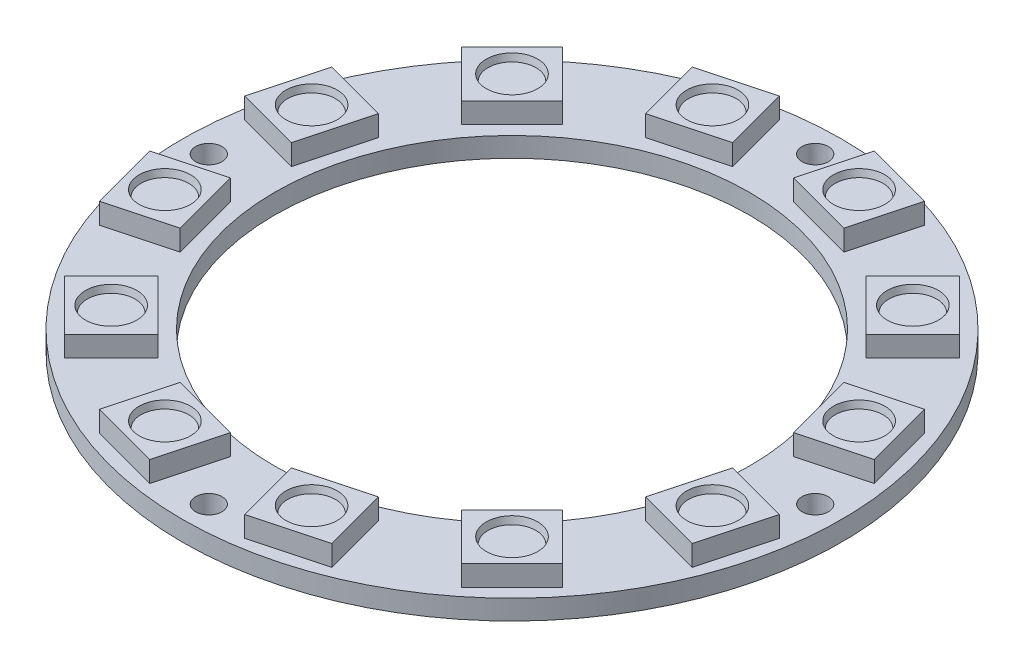
from build123d import *

# Parameters (mm, degrees)
CONTOUR_W                                   = 7
CONTOUR_H                                   = 1.5
BOSS_EXTRU_2_RGB_DEL_DEPTH                  = 1.57
R_P_TITION_CIRCULAIRE1_RGB_DEL_COUNT        = 12
BEIGNETS_SOUDURES_R                         = 0.875
BOSS_EXTRU_3_BEIGNETS_SOUDURES_DEPTH        = 0.0348
LENTILLE_R                                  = 1.95
ENL_V_MAT_EXTRU_1_LENTILLE_DEPTH            = 0.5
ENL_V_MAT_EXTRU_1_LENTILLE_DRAFT            = -15
R_P_TITION_CIRCULAIRE1_COPY_1_SKETCH_R      = 1.95
R_P_TITION_CIRCULAIRE1_COPY_1_DEPTH         = 0.5
R_P_TITION_CIRCULAIRE1_COPY_1_DRAFT         = -15
R_P_TITION_CIRCULAIRE1_COPY_2_SKETCH_R      = 1.95
R_P_TITION_CIRCULAIRE1_COPY_2_DEPTH         = 0.5
R_P_TITION_CIRCULAIRE1_COPY_2_DRAFT         = -15
R_P_TITION_CIRCULAIRE1_COPY_3_SKETCH_R      = 1.95
R_P_TITION_CIRCULAIRE1_COPY_3_DEPTH         = 0.5
R_P_TITION_CIRCULAIRE1_COPY_3_DRAFT         = -15
R_P_TITION_CIRCULAIRE1_COPY_4_SKETCH_R      = 1.95
R_P_TITION_CIRCULAIRE1_COPY_4_DEPTH         = 0.5
R_P_TITION_CIRCULAIRE1_COPY_4_DRAFT         = -15
R_P_TITION_CIRCULAIRE1_COPY_5_SKETCH_R      = 1.95
R_P_TITION_CIRCULAIRE1_COPY_5_DEPTH         = 0.5
R_P_TITION_CIRCULAIRE1_COPY_5_DRAFT         = -15
R_P_TITION_CIRCULAIRE1_COPY_6_SKETCH_R      = 1.95
R_P_TITION_CIRCULAIRE1_COPY_6_DEPTH         = 0.5
R_P_TITION_CIRCULAIRE1_COPY_6_DRAFT         = -15
R_P_TITION_CIRCULAIRE1_COPY_7_SKETCH_R      = 1.95
R_P_TITION_CIRCULAIRE1_COPY_7_DEPTH         = 0.5
R_P_TITION_CIRCULAIRE1_COPY_7_DRAFT         = -15
R_P_TITION_CIRCULAIRE1_COPY_8_SKETCH_R      = 1.95
R_P_TITION_CIRCULAIRE1_COPY_8_DEPTH         = 0.5
R_P_TITION_CIRCULAIRE1_COPY_8_DRAFT         = -15
R_P_TITION_CIRCULAIRE1_COPY_9_SKETCH_R      = 1.95
R_P_TITION_CIRCULAIRE1_COPY_9_DEPTH         = 0.5
R_P_TITION_CIRCULAIRE1_COPY_9_DRAFT         = -15
R_P_TITION_CIRCULAIRE1_COPY_10_SKETCH_R     = 1.95
R_P_TITION_CIRCULAIRE1_COPY_10_DEPTH        = 0.5
R_P_TITION_CIRCULAIRE1_COPY_10_DRAFT        = -15
R_P_TITION_CIRCULAIRE1_COPY_11_SKETCH_R     = 1.95
R_P_TITION_CIRCULAIRE1_COPY_11_DEPTH        = 0.5
R_P_TITION_CIRCULAIRE1_COPY_11_DRAFT        = -15
TOUS_MONTAGE_VIS_M2_ANNEAU_RGB_R            = 1
ENL_V_MAT_EXTRU_1_TOUS_MONTAGE_VIS_M2_DEPTH = 2.5


with BuildPart() as part:
    # Contour → Révolution1_Contour (revolve)
    with BuildSketch(Plane.XY, mode=Mode.PRIVATE) as r_volution1_contour_sk:
        with Locations((21.5, 0)):
            Rectangle(CONTOUR_W, CONTOUR_H)
    revolve(r_volution1_contour_sk.sketch.rotate(Axis((0, 0.825, 0), (0, -1, 0)), 90), axis=Axis((0, 0.825, 0), (0, -1, 0)))

    # RGB_DEL → Boss.-Extru.2_RGB_DEL (add)
    with BuildSketch(Plane(origin=(0, 0.75, 0), x_dir=(1, 0, 0), z_dir=(0, 1, 0))):
        Polygon((-15.344217152, 11.525840533), (-11.525840533, 15.344217152), (-15.061374439, 18.879751058), (-18.879751058, 15.061374439), align=None)
    boss_extru_2_rgb_del = extrude(amount=BOSS_EXTRU_2_RGB_DEL_DEPTH)

    # Répétition circulaire1_RGB_DEL: Boss.-Extru.2_RGB_DEL ×12 about axis
    r_p_tition_circulaire1_rgb_del_axis = Axis((0, 0, 0), (0, 1, 0))
    for i in range(1, R_P_TITION_CIRCULAIRE1_RGB_DEL_COUNT):
        add(boss_extru_2_rgb_del.rotate(r_p_tition_circulaire1_rgb_del_axis, i * 360 / R_P_TITION_CIRCULAIRE1_RGB_DEL_COUNT))

    # Beignets_soudures → Boss.-Extru.3_Beignets_soudures (add)
    with BuildSketch(Plane(origin=(0, -0.75, 0), x_dir=(-1, 0, 0), z_dir=(0, -1, 0))):
        with Locations(Location((12.508718959, 17.896872632, 0), (0, 0, 270))):
            Circle(BEIGNETS_SOUDURES_R)
        with Locations(Location((14.304770183, 16.100821408, 0), (0, 0, 270))):
            Circle(BEIGNETS_SOUDURES_R)
        with Locations(Location((16.100821408, 14.304770183, 0), (0, 0, 270))):
            Circle(BEIGNETS_SOUDURES_R)
        with Locations(Location((17.896872632, 12.508718959, 0), (0, 0, 270))):
            Circle(BEIGNETS_SOUDURES_R)
    extrude(amount=BOSS_EXTRU_3_BEIGNETS_SOUDURES_DEPTH)


with BuildPart() as enl_v_mat_extru_1_lentille_tool:
    # Lentille → Enlèv. mat.-Extru.1_Lentille (with draft: the straight prism first)
    with BuildSketch(Plane(origin=(0, 2.32, 0), x_dir=(1, 0, 0), z_dir=(0, 1, 0))):
        with Locations((-15.202795796, 15.202795796)):
            Circle(LENTILLE_R)
    extrude(amount=-ENL_V_MAT_EXTRU_1_LENTILLE_DEPTH)
    # Enlèv. mat.-Extru.1_Lentille: the draft: its side faces are tilted about the plane it starts from
    enl_v_mat_extru_1_lentille_sides = [enl_v_mat_extru_1_lentille_tool.faces().sort_by_distance(p)[0] for p in [
        (-17.152795796, 2.07, -15.202795796),
    ]]
    draft(enl_v_mat_extru_1_lentille_sides, Plane(origin=(0, 2.32, 0), x_dir=(1, 0, 0), z_dir=(0, 1, 0)), ENL_V_MAT_EXTRU_1_LENTILLE_DRAFT)


with BuildPart() as part_1:
    add(part.part)

    # Enlèv. mat.-Extru.1_Lentille: cut by enl_v_mat_extru_1_lentille_tool
    add(enl_v_mat_extru_1_lentille_tool.part, mode=Mode.SUBTRACT)


with BuildPart() as r_p_tition_circulaire1_copy_1_tool:
    # Répétition circulaire1 copy 1 sketch → Répétition circulaire1 copy 1 (with draft: the straight prism first)
    with BuildSketch(Plane(origin=(0, 2.32, 0), x_dir=(0.8660254037844387, 0, -0.49999999999999994), z_dir=(0, 1, 0))):
        with Locations((-15.202795796, 15.202795796)):
            Circle(R_P_TITION_CIRCULAIRE1_COPY_1_SKETCH_R)
    extrude(amount=-R_P_TITION_CIRCULAIRE1_COPY_1_DEPTH)
    # Répétition circulaire1 copy 1: the draft: its side faces are tilted about the plane it starts from
    r_p_tition_circulaire1_copy_1_sides = [r_p_tition_circulaire1_copy_1_tool.faces().sort_by_distance(p)[0] for p in [
        (-22.456154803, 2.07, -4.58960947),
    ]]
    draft(r_p_tition_circulaire1_copy_1_sides, Plane(origin=(0, 2.32, 0), x_dir=(0.8660254037844387, 0, -0.49999999999999994), z_dir=(0, 1, 0)), R_P_TITION_CIRCULAIRE1_COPY_1_DRAFT)


with BuildPart() as part_2:
    add(part_1.part)

    # Répétition circulaire1 copy 1: cut by r_p_tition_circulaire1_copy_1_tool
    add(r_p_tition_circulaire1_copy_1_tool.part, mode=Mode.SUBTRACT)


with BuildPart() as r_p_tition_circulaire1_copy_2_tool:
    # Répétition circulaire1 copy 2 sketch → Répétition circulaire1 copy 2 (with draft: the straight prism first)
    with BuildSketch(Plane(origin=(0, 2.32, 0), x_dir=(0.5000000000000001, 0, -0.8660254037844386), z_dir=(0, 1, 0))):
        with Locations((-15.202795796, 15.202795796)):
            Circle(R_P_TITION_CIRCULAIRE1_COPY_2_SKETCH_R)
    extrude(amount=-R_P_TITION_CIRCULAIRE1_COPY_2_DEPTH)
    # Répétition circulaire1 copy 2: the draft: its side faces are tilted about the plane it starts from
    r_p_tition_circulaire1_copy_2_sides = [r_p_tition_circulaire1_copy_2_tool.faces().sort_by_distance(p)[0] for p in [
        (-21.742405266, 2.07, 7.253359007),
    ]]
    draft(r_p_tition_circulaire1_copy_2_sides, Plane(origin=(0, 2.32, 0), x_dir=(0.5000000000000001, 0, -0.8660254037844386), z_dir=(0, 1, 0)), R_P_TITION_CIRCULAIRE1_COPY_2_DRAFT)


with BuildPart() as part_3:
    add(part_2.part)

    # Répétition circulaire1 copy 2: cut by r_p_tition_circulaire1_copy_2_tool
    add(r_p_tition_circulaire1_copy_2_tool.part, mode=Mode.SUBTRACT)


with BuildPart() as r_p_tition_circulaire1_copy_3_tool:
    # Répétition circulaire1 copy 3 sketch → Répétition circulaire1 copy 3 (with draft: the straight prism first)
    with BuildSketch(Plane(origin=(0, 2.32, 0), x_dir=(0, 0, -1), z_dir=(0, 1, 0))):
        with Locations((-15.202795796, 15.202795796)):
            Circle(R_P_TITION_CIRCULAIRE1_COPY_3_SKETCH_R)
    extrude(amount=-R_P_TITION_CIRCULAIRE1_COPY_3_DEPTH)
    # Répétition circulaire1 copy 3: the draft: its side faces are tilted about the plane it starts from
    r_p_tition_circulaire1_copy_3_sides = [r_p_tition_circulaire1_copy_3_tool.faces().sort_by_distance(p)[0] for p in [
        (-15.202795796, 2.07, 17.152795796),
    ]]
    draft(r_p_tition_circulaire1_copy_3_sides, Plane(origin=(0, 2.32, 0), x_dir=(0, 0, -1), z_dir=(0, 1, 0)), R_P_TITION_CIRCULAIRE1_COPY_3_DRAFT)


with BuildPart() as part_4:
    add(part_3.part)

    # Répétition circulaire1 copy 3: cut by r_p_tition_circulaire1_copy_3_tool
    add(r_p_tition_circulaire1_copy_3_tool.part, mode=Mode.SUBTRACT)


with BuildPart() as r_p_tition_circulaire1_copy_4_tool:
    # Répétition circulaire1 copy 4 sketch → Répétition circulaire1 copy 4 (with draft: the straight prism first)
    with BuildSketch(Plane(origin=(0, 2.32, 0), x_dir=(-0.4999999999999998, 0, -0.8660254037844387), z_dir=(0, 1, 0))):
        with Locations((-15.202795796, 15.202795796)):
            Circle(R_P_TITION_CIRCULAIRE1_COPY_4_SKETCH_R)
    extrude(amount=-R_P_TITION_CIRCULAIRE1_COPY_4_DEPTH)
    # Répétition circulaire1 copy 4: the draft: its side faces are tilted about the plane it starts from
    r_p_tition_circulaire1_copy_4_sides = [r_p_tition_circulaire1_copy_4_tool.faces().sort_by_distance(p)[0] for p in [
        (-4.58960947, 2.07, 22.456154803),
    ]]
    draft(r_p_tition_circulaire1_copy_4_sides, Plane(origin=(0, 2.32, 0), x_dir=(-0.4999999999999998, 0, -0.8660254037844387), z_dir=(0, 1, 0)), R_P_TITION_CIRCULAIRE1_COPY_4_DRAFT)


with BuildPart() as part_5:
    add(part_4.part)

    # Répétition circulaire1 copy 4: cut by r_p_tition_circulaire1_copy_4_tool
    add(r_p_tition_circulaire1_copy_4_tool.part, mode=Mode.SUBTRACT)


with BuildPart() as r_p_tition_circulaire1_copy_5_tool:
    # Répétition circulaire1 copy 5 sketch → Répétition circulaire1 copy 5 (with draft: the straight prism first)
    with BuildSketch(Plane(origin=(0, 2.32, 0), x_dir=(-0.8660254037844387, 0, -0.49999999999999994), z_dir=(0, 1, 0))):
        with Locations((-15.202795796, 15.202795796)):
            Circle(R_P_TITION_CIRCULAIRE1_COPY_5_SKETCH_R)
    extrude(amount=-R_P_TITION_CIRCULAIRE1_COPY_5_DEPTH)
    # Répétition circulaire1 copy 5: the draft: its side faces are tilted about the plane it starts from
    r_p_tition_circulaire1_copy_5_sides = [r_p_tition_circulaire1_copy_5_tool.faces().sort_by_distance(p)[0] for p in [
        (7.253359007, 2.07, 21.742405266),
    ]]
    draft(r_p_tition_circulaire1_copy_5_sides, Plane(origin=(0, 2.32, 0), x_dir=(-0.8660254037844387, 0, -0.49999999999999994), z_dir=(0, 1, 0)), R_P_TITION_CIRCULAIRE1_COPY_5_DRAFT)


with BuildPart() as part_6:
    add(part_5.part)

    # Répétition circulaire1 copy 5: cut by r_p_tition_circulaire1_copy_5_tool
    add(r_p_tition_circulaire1_copy_5_tool.part, mode=Mode.SUBTRACT)


with BuildPart() as r_p_tition_circulaire1_copy_6_tool:
    # Répétition circulaire1 copy 6 sketch → Répétition circulaire1 copy 6 (with draft: the straight prism first)
    with BuildSketch(Plane(origin=(0, 2.32, 0), x_dir=(-1, 0, 0), z_dir=(0, 1, 0))):
        with Locations((-15.202795796, 15.202795796)):
            Circle(R_P_TITION_CIRCULAIRE1_COPY_6_SKETCH_R)
    extrude(amount=-R_P_TITION_CIRCULAIRE1_COPY_6_DEPTH)
    # Répétition circulaire1 copy 6: the draft: its side faces are tilted about the plane it starts from
    r_p_tition_circulaire1_copy_6_sides = [r_p_tition_circulaire1_copy_6_tool.faces().sort_by_distance(p)[0] for p in [
        (17.152795796, 2.07, 15.202795796),
    ]]
    draft(r_p_tition_circulaire1_copy_6_sides, Plane(origin=(0, 2.32, 0), x_dir=(-1, 0, 0), z_dir=(0, 1, 0)), R_P_TITION_CIRCULAIRE1_COPY_6_DRAFT)


with BuildPart() as part_7:
    add(part_6.part)

    # Répétition circulaire1 copy 6: cut by r_p_tition_circulaire1_copy_6_tool
    add(r_p_tition_circulaire1_copy_6_tool.part, mode=Mode.SUBTRACT)


with BuildPart() as r_p_tition_circulaire1_copy_7_tool:
    # Répétition circulaire1 copy 7 sketch → Répétition circulaire1 copy 7 (with draft: the straight prism first)
    with BuildSketch(Plane(origin=(0, 2.32, 0), x_dir=(-0.8660254037844386, 0, 0.5000000000000001), z_dir=(0, 1, 0))):
        with Locations((-15.202795796, 15.202795796)):
            Circle(R_P_TITION_CIRCULAIRE1_COPY_7_SKETCH_R)
    extrude(amount=-R_P_TITION_CIRCULAIRE1_COPY_7_DEPTH)
    # Répétition circulaire1 copy 7: the draft: its side faces are tilted about the plane it starts from
    r_p_tition_circulaire1_copy_7_sides = [r_p_tition_circulaire1_copy_7_tool.faces().sort_by_distance(p)[0] for p in [
        (22.456154803, 2.07, 4.58960947),
    ]]
    draft(r_p_tition_circulaire1_copy_7_sides, Plane(origin=(0, 2.32, 0), x_dir=(-0.8660254037844386, 0, 0.5000000000000001), z_dir=(0, 1, 0)), R_P_TITION_CIRCULAIRE1_COPY_7_DRAFT)


with BuildPart() as part_8:
    add(part_7.part)

    # Répétition circulaire1 copy 7: cut by r_p_tition_circulaire1_copy_7_tool
    add(r_p_tition_circulaire1_copy_7_tool.part, mode=Mode.SUBTRACT)


with BuildPart() as r_p_tition_circulaire1_copy_8_tool:
    # Répétition circulaire1 copy 8 sketch → Répétition circulaire1 copy 8 (with draft: the straight prism first)
    with BuildSketch(Plane(origin=(0, 2.32, 0), x_dir=(-0.5000000000000004, 0, 0.8660254037844384), z_dir=(0, 1, 0))):
        with Locations((-15.202795796, 15.202795796)):
            Circle(R_P_TITION_CIRCULAIRE1_COPY_8_SKETCH_R)
    extrude(amount=-R_P_TITION_CIRCULAIRE1_COPY_8_DEPTH)
    # Répétition circulaire1 copy 8: the draft: its side faces are tilted about the plane it starts from
    r_p_tition_circulaire1_copy_8_sides = [r_p_tition_circulaire1_copy_8_tool.faces().sort_by_distance(p)[0] for p in [
        (21.742405266, 2.07, -7.253359007),
    ]]
    draft(r_p_tition_circulaire1_copy_8_sides, Plane(origin=(0, 2.32, 0), x_dir=(-0.5000000000000004, 0, 0.8660254037844384), z_dir=(0, 1, 0)), R_P_TITION_CIRCULAIRE1_COPY_8_DRAFT)


with BuildPart() as part_9:
    add(part_8.part)

    # Répétition circulaire1 copy 8: cut by r_p_tition_circulaire1_copy_8_tool
    add(r_p_tition_circulaire1_copy_8_tool.part, mode=Mode.SUBTRACT)


with BuildPart() as r_p_tition_circulaire1_copy_9_tool:
    # Répétition circulaire1 copy 9 sketch → Répétition circulaire1 copy 9 (with draft: the straight prism first)
    with BuildSketch(Plane.ZX.offset(2.32)):
        with Locations((-15.202795796, 15.202795796)):
            Circle(R_P_TITION_CIRCULAIRE1_COPY_9_SKETCH_R)
    extrude(amount=-R_P_TITION_CIRCULAIRE1_COPY_9_DEPTH)
    # Répétition circulaire1 copy 9: the draft: its side faces are tilted about the plane it starts from
    r_p_tition_circulaire1_copy_9_sides = [r_p_tition_circulaire1_copy_9_tool.faces().sort_by_distance(p)[0] for p in [
        (15.202795796, 2.07, -17.152795796),
    ]]
    draft(r_p_tition_circulaire1_copy_9_sides, Plane.ZX.offset(2.32), R_P_TITION_CIRCULAIRE1_COPY_9_DRAFT)


with BuildPart() as part_10:
    add(part_9.part)

    # Répétition circulaire1 copy 9: cut by r_p_tition_circulaire1_copy_9_tool
    add(r_p_tition_circulaire1_copy_9_tool.part, mode=Mode.SUBTRACT)


with BuildPart() as r_p_tition_circulaire1_copy_10_tool:
    # Répétition circulaire1 copy 10 sketch → Répétition circulaire1 copy 10 (with draft: the straight prism first)
    with BuildSketch(Plane(origin=(0, 2.32, 0), x_dir=(0.5000000000000001, 0, 0.8660254037844386), z_dir=(0, 1, 0))):
        with Locations((-15.202795796, 15.202795796)):
            Circle(R_P_TITION_CIRCULAIRE1_COPY_10_SKETCH_R)
    extrude(amount=-R_P_TITION_CIRCULAIRE1_COPY_10_DEPTH)
    # Répétition circulaire1 copy 10: the draft: its side faces are tilted about the plane it starts from
    r_p_tition_circulaire1_copy_10_sides = [r_p_tition_circulaire1_copy_10_tool.faces().sort_by_distance(p)[0] for p in [
        (4.58960947, 2.07, -22.456154803),
    ]]
    draft(r_p_tition_circulaire1_copy_10_sides, Plane(origin=(0, 2.32, 0), x_dir=(0.5000000000000001, 0, 0.8660254037844386), z_dir=(0, 1, 0)), R_P_TITION_CIRCULAIRE1_COPY_10_DRAFT)


with BuildPart() as part_11:
    add(part_10.part)

    # Répétition circulaire1 copy 10: cut by r_p_tition_circulaire1_copy_10_tool
    add(r_p_tition_circulaire1_copy_10_tool.part, mode=Mode.SUBTRACT)


with BuildPart() as r_p_tition_circulaire1_copy_11_tool:
    # Répétition circulaire1 copy 11 sketch → Répétition circulaire1 copy 11 (with draft: the straight prism first)
    with BuildSketch(Plane(origin=(0, 2.32, 0), x_dir=(0.8660254037844384, 0, 0.5000000000000004), z_dir=(0, 1, 0))):
        with Locations((-15.202795796, 15.202795796)):
            Circle(R_P_TITION_CIRCULAIRE1_COPY_11_SKETCH_R)
    extrude(amount=-R_P_TITION_CIRCULAIRE1_COPY_11_DEPTH)
    # Répétition circulaire1 copy 11: the draft: its side faces are tilted about the plane it starts from
    r_p_tition_circulaire1_copy_11_sides = [r_p_tition_circulaire1_copy_11_tool.faces().sort_by_distance(p)[0] for p in [
        (-7.253359007, 2.07, -21.742405266),
    ]]
    draft(r_p_tition_circulaire1_copy_11_sides, Plane(origin=(0, 2.32, 0), x_dir=(0.8660254037844384, 0, 0.5000000000000004), z_dir=(0, 1, 0)), R_P_TITION_CIRCULAIRE1_COPY_11_DRAFT)


with BuildPart() as part_12:
    add(part_11.part)

    # Répétition circulaire1 copy 11: cut by r_p_tition_circulaire1_copy_11_tool
    add(r_p_tition_circulaire1_copy_11_tool.part, mode=Mode.SUBTRACT)

    # Tous_Montage_Vis_M2_Anneau_RGB → Enlèv. mat.-Extru.1_Tous_Montage_Vis_M2_Anneau_RGB (cut, symmetric)
    with BuildSketch(Plane(origin=(0, 0, 0), x_dir=(1, 0, 0), z_dir=(0, 1, 0))):
        with Locations(Location((-23, 0, 0), (0, 0, 270))):
            Circle(TOUS_MONTAGE_VIS_M2_ANNEAU_RGB_R)
        with Locations(Location((0, 23, 0), (0, 0, 270))):
            Circle(TOUS_MONTAGE_VIS_M2_ANNEAU_RGB_R)
        with Locations(Location((23, 0, 0), (0, 0, 270))):
            Circle(TOUS_MONTAGE_VIS_M2_ANNEAU_RGB_R)
        with Locations(Location((0, -23, 0), (0, 0, 270))):
            Circle(TOUS_MONTAGE_VIS_M2_ANNEAU_RGB_R)
    extrude(amount=ENL_V_MAT_EXTRU_1_TOUS_MONTAGE_VIS_M2_DEPTH, both=True, mode=Mode.SUBTRACT)


solid = part_12.part
